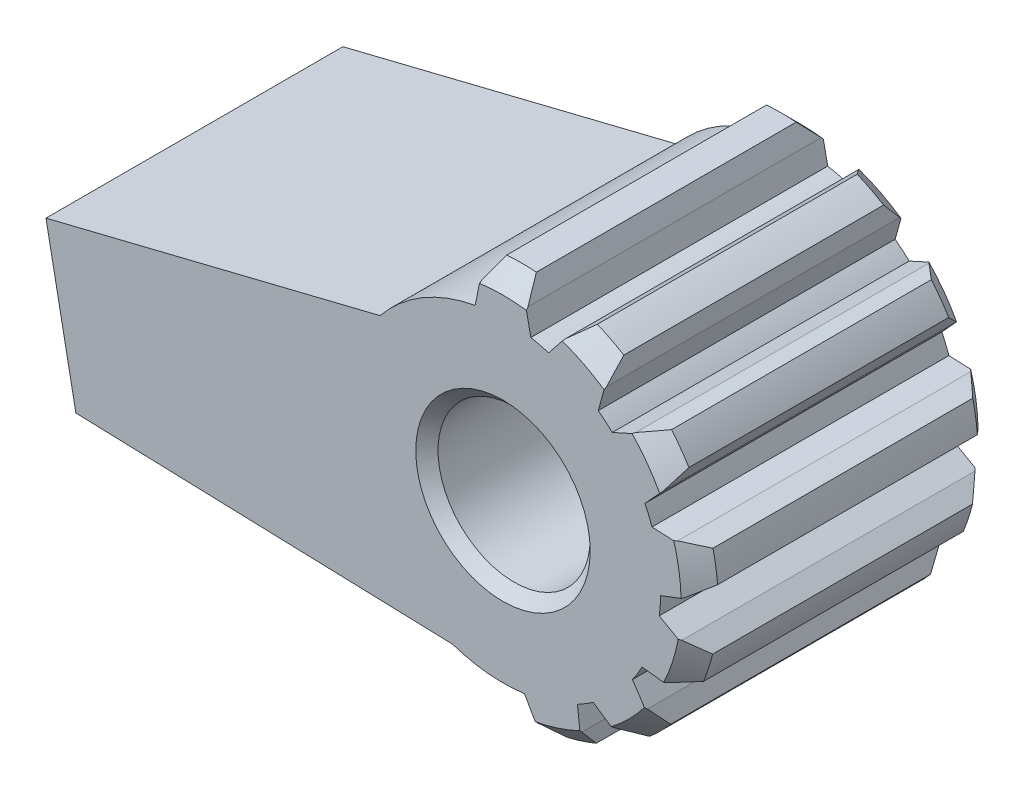
from build123d import *

# Parameters (mm, degrees)
SKETCH_1_R               = 2.05
EXTRUDE_1_DEPTH          = 4
PATTERN_CIRCULAR_1_COUNT = 7
PATTERN_CIRCULAR_1_ANGLE = 162
CHAMFER_1_SIZE           = 0.5
CHAMFER_2_SIZE           = 0.5
CHAMFER_3_SIZE           = 0.3
EXTRUDE_2_DEPTH          = 4


with BuildPart() as part:
    # 스케치1 → 보스-돌출1 (new, symmetric)
    with BuildSketch(Plane.XY):
        with BuildLine():
            ThreePointArc((-0.75, 4.183300133), (0, -4.25), (0.75, 4.183300133))
            Line((0.75, 4.183300133), (0.621752267, 4.811019676))
            Line((0.621752267, 4.811019676), (0.4, 5.284884105))
            ThreePointArc((0.4, 5.284884105), (0, 5.3), (-0.4, 5.284884105))
            Line((-0.4, 5.284884105), (-0.621752267, 4.811019676))
            Line((-0.621752267, 4.811019676), (-0.75, 4.183300133))
        make_face()
        Circle(SKETCH_1_R, mode=Mode.SUBTRACT)
    extrude_1 = extrude(amount=EXTRUDE_1_DEPTH, both=True)

    # 원형 패턴1: 보스-돌출1 ×7 about axis
    pattern_circular_1_axis = Axis((0, 0, 0), (0, 0, -1))
    for i in range(1, PATTERN_CIRCULAR_1_COUNT):
        add(extrude_1.rotate(pattern_circular_1_axis, i * PATTERN_CIRCULAR_1_ANGLE / (PATTERN_CIRCULAR_1_COUNT - 1)))

    # 모따기1
    chamfer_1_edges = [part.edges().sort_by_distance(p)[0] for p in [
        (0, 5.3, -4),
        (1.63779007, -5.040599536, -4),
        (3.74766594, -3.74766594, -4),
        (5.040599536, -1.63779007, -4),
        (5.234748205, 0.829102665, -4),
        (4.28779007, 3.115261837, -4),
        (2.406149649, 4.722334578, -4),
    ]]
    chamfer(chamfer_1_edges, length=CHAMFER_1_SIZE)

    # 모따기2
    chamfer_2_edges = [part.edges().sort_by_distance(p)[0] for p in [
        (0, 5.3, 4),
        (2.406149649, 4.722334578, 4),
        (4.28779007, 3.115261837, 4),
        (5.234748205, 0.829102665, 4),
        (5.040599536, -1.63779007, 4),
        (3.74766594, -3.74766594, 4),
        (1.63779007, -5.040599536, 4),
    ]]
    chamfer(chamfer_2_edges, length=CHAMFER_2_SIZE)

    # 모따기3
    chamfer_3_edges = [part.edges().sort_by_distance(p)[0] for p in [
        (-2.05, 0, 4),
        (-2.05, 0, -4),
    ]]
    chamfer(chamfer_3_edges, length=CHAMFER_3_SIZE)

    # 스케치4 → 보스-돌출2 (add, symmetric)
    with BuildSketch(Plane.XY):
        Polygon((-11.50806015, -3.706831149), (-1.358605926, -4.02699515), (-3.310771403, 2.664825081), (-12.312685829, 0.439367534), align=None)
    extrude(amount=EXTRUDE_2_DEPTH, both=True)


solid = part.part
